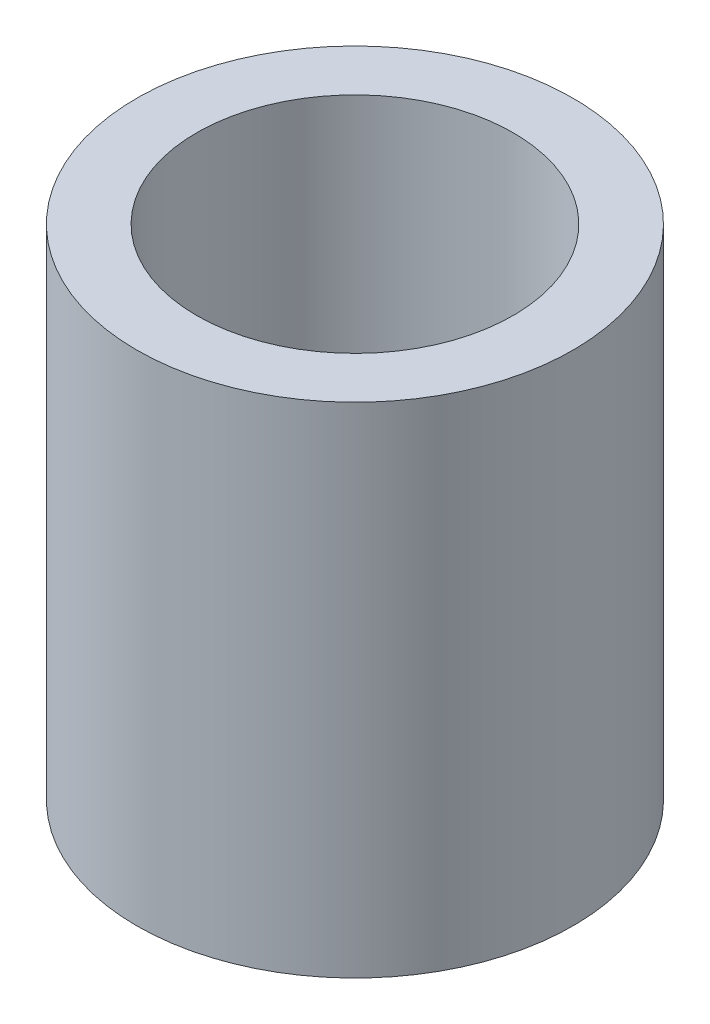
from build123d import *

# Parameters (mm, degrees)
SKETCH1_R           = 3.5
SKETCH1_R_2         = 2.54
BOSS_EXTRUDE1_DEPTH = 4


with BuildPart() as part:
    # Sketch1 → Boss-Extrude1 (new, symmetric)
    with BuildSketch(Plane(origin=(0, 0, 0), x_dir=(1, 0, 0), z_dir=(0, 1, 0))):
        with Locations(Location((0, 0, 0), (0, 0, 270))):
            Circle(SKETCH1_R)
        with Locations(Location((0, 0, 0), (0, 0, 270))):
            Circle(SKETCH1_R_2, mode=Mode.SUBTRACT)
    extrude(amount=BOSS_EXTRUDE1_DEPTH, both=True)


solid = part.part
